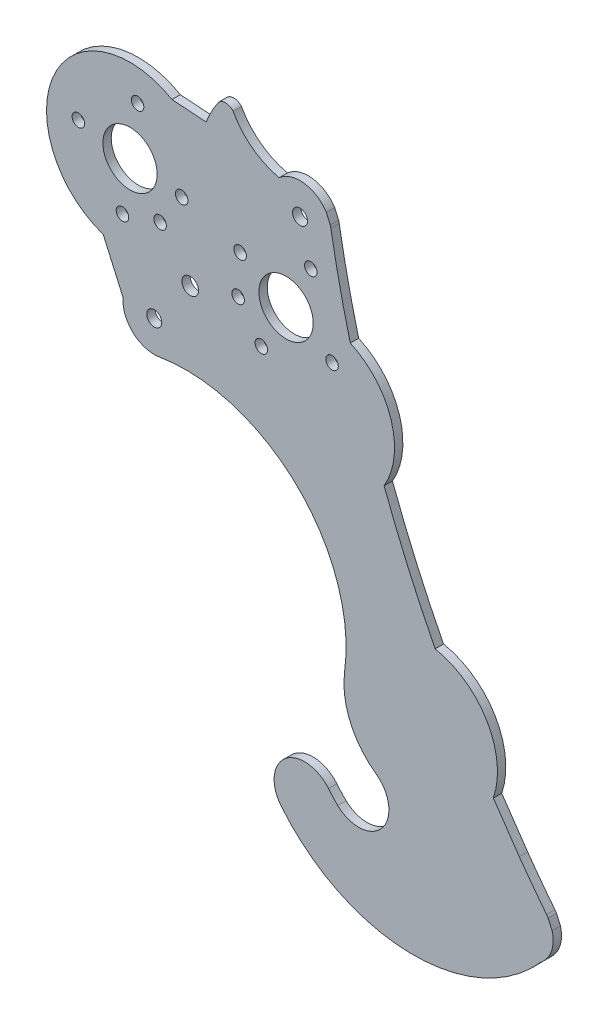
from build123d import *
from build123d.topology import SkipClean

# Parameters (mm, degrees)
SKETCH1_R            = 1.8
SKETCH1_R_2          = 2.75
EXTRUDE2_DEPTH       = 2
EXTRUDE3_START       = -2
EXTRUDE3_DEPTH       = 2
EXTRUDE4_DEPTH       = 2
EXTRUDE5_DEPTH       = 10
SKETCH5_R            = 3
EXTRUDE6_DEPTH       = 55
BOSS_EXTRUDE2_DEPTH  = 2
CUT_EXTRUDE2_DEPTH   = 10
BOSS_EXTRUDE3_DEPTH  = 2
CUT_EXTRUDE3_DEPTH   = 10
BOSS_EXTRUDE4_DEPTH  = 2
BOSS_EXTRUDE5_DEPTH  = 2
SKETCH11_R           = 3
CUT_EXTRUDE4_DEPTH   = 10
BOSS_EXTRUDE6_DEPTH  = 2
BOSS_EXTRUDE7_DEPTH  = 2
SKETCH16_R           = 3.342245342
SKETCH16_R_2         = 2
BOSS_EXTRUDE8_DEPTH  = 2
CUT_EXTRUDE5_DEPTH   = 2
SKETCH17_R           = 1.5
SKETCH17_R_2         = 6.5
SKETCH17_R_3         = 3
BOSS_EXTRUDE9_DEPTH  = 2
SKETCH17_2_R         = 1.5
SKETCH17_2_R_2       = 6.5
CUT_EXTRUDE6_DEPTH   = 2
BOSS_EXTRUDE11_DEPTH = 2
CUT_EXTRUDE8_DEPTH   = 2


with BuildPart() as part:
    # Sketch1 → Extrude2 (new body)
    with BuildSketch(Plane.XY):
        with BuildLine():
            Line((214.950942091, 33.616874637), (221.807190432, 36.656917184))
            Line((221.807190432, 36.656917184), (220.185834407, 40.313582966))
            Line((220.185834407, 40.313582966), (249.033490074, 53.104557885))
            ThreePointArc((249.033490074, 53.104557885), (251.717229956, 54.156321533), (254.312398254, 52.901822418))
            Line((254.312398254, 52.901822418), (279.296283012, 23.753956867))
            ThreePointArc((279.296283012, 23.753956867), (280.042564492, 18.410715952), (275.5, 15.5))
            Line((275.5, 15.5), (223.5, 15.5))
            ThreePointArc((223.5, 15.5), (220.722148835, 16.342651938), (218.880602337, 18.586582838))
            Line((218.880602337, 18.586582838), (211.044169952, 36.260192904))
            Line((211.044169952, 36.260192904), (213.329586066, 37.27354042))
            Line((213.329586066, 37.27354042), (214.950942091, 33.616874637))
        make_face()
        with Locations((275.5, 20.5)):
            Circle(SKETCH1_R, mode=Mode.SUBTRACT)
        with Locations((251.5, 48.5)):
            Circle(SKETCH1_R_2, mode=Mode.SUBTRACT)
        with Locations((223.5, 20.5)):
            Circle(SKETCH1_R, mode=Mode.SUBTRACT)
    extrude(amount=EXTRUDE2_DEPTH)

    # Sketch2 → Extrude3 (add)
    with BuildSketch(Plane.XY.offset(2).offset(EXTRUDE3_START)):
        with BuildLine():
            Line((275.035821138, 64.633923334), (251.401662381, 54.15459928))
            ThreePointArc((251.401662381, 54.15459928), (253.0022869, 53.865703947), (254.312398254, 52.901822418))
            Line((254.312398254, 52.901822418), (265.867761021, 39.420565857))
            Line((265.867761021, 39.420565857), (282.872253523, 46.960313268))
            Line((282.872253523, 46.960313268), (275.035821138, 64.633923334))
        make_face()
        with BuildLine():
            Line((264.774418622, 15.5), (268.520870849, 7.050576522))
            Line((268.520870849, 7.050576522), (295.302771445, 18.925601058))
            Line((295.302771445, 18.925601058), (282.872253523, 46.960313268))
            Line((282.872253523, 46.960313268), (265.867761021, 39.420565857))
            Line((265.867761021, 39.420565857), (279.296283012, 23.753956867))
            ThreePointArc((279.296283012, 23.753956867), (280.042564492, 18.410715952), (275.5, 15.5))
            Line((275.5, 15.5), (264.774418622, 15.5))
        make_face()
        with BuildLine():
            ThreePointArc((223.5, 15.5), (222.085748932, 15.704179537), (220.787002315, 16.300042433))
            ThreePointArc((220.787002315, 16.300042433), (243.759401886, 7.058869787), (268.520870849, 7.050576522))
            Line((268.520870849, 7.050576522), (264.774418622, 15.5))
            Line((264.774418622, 15.5), (223.5, 15.5))
        make_face()
        with BuildLine():
            Line((295.302771445, 18.925601058), (268.520870849, 7.050576522))
            ThreePointArc((268.520870849, 7.050576522), (282.58749462, 11.46423343), (295.302771445, 18.925601058))
        make_face()
    extrude(amount=EXTRUDE3_DEPTH)


with BuildPart() as body_2:
    # Mirror2: mirrored copy
    add(part.part.mirror(Plane(origin=(11.104903497, -25.045036387, 0), x_dir=(0, 0, 1), z_dir=(-0.4053390061385553, 0.9141664455134023, 0))))


with BuildPart() as part_1:
    add(part.part)

    add(body_2.part)  # Extrude4 merges body 2
    # Sketch3 → Extrude4 (add)
    with BuildSketch(Plane.XY.offset(2)):
        Polygon((275.035821138, 64.633923334), (254.768870831, 110.34224561), (190.777219645, 81.96851518), (211.044169952, 36.260192904), align=None)
    extrude(amount=-EXTRUDE4_DEPTH)

    # Sketch4 → Extrude5 (cut)
    with BuildSketch(Plane.XY.offset(2)):
        Polygon((262.406775751, 78.177359931), (258.750109969, 76.556003907), (252.670024877, 90.26850059), (256.326690659, 91.889856614), align=None)
        Polygon((286.72711612, 23.327373201), (283.070450338, 21.706017176), (276.990365245, 35.418513859), (280.647031028, 37.039869883), align=None)
        Polygon((234.429769601, 131.405990638), (238.086435383, 133.027346662), (232.006350291, 146.739843345), (228.349684509, 145.11848732), align=None)
    extrude(amount=-EXTRUDE5_DEPTH, mode=Mode.SUBTRACT)

    # Sketch5 → Extrude6 (cut)
    with BuildSketch(Plane.XY.offset(2)):
        with Locations((239.255071404, 76.116150138)):
            Circle(SKETCH5_R)
    extrude(amount=-EXTRUDE6_DEPTH, mode=Mode.SUBTRACT)

    # Sketch8 → Boss-Extrude2 (add)
    with BuildSketch(Plane(origin=(0, 0, 0), x_dir=(-1, 0, 0), z_dir=(0, 0, -1))):
        Polygon((-198.724451181, 91.591049062), (-189.767325125, 87.770757271), (-210.762968813, 38.543986786), (-219.72009487, 42.364278577), align=None)
    extrude(amount=-BOSS_EXTRUDE2_DEPTH)

    # Sketch6 → Cut-Extrude2 (cut)
    with BuildSketch(Plane.XY.offset(2)):
        Polygon((215.30566699, 32.68026603), (222.161915332, 35.720308576), (220.540559307, 39.376974358), (213.684310966, 36.336931812), align=None)
    cut_extrude2 = extrude(amount=-CUT_EXTRUDE2_DEPTH, mode=Mode.SUBTRACT)

    # Mirror3: Cut-Extrude2 across plane
    add(cut_extrude2.mirror(Plane(origin=(11.104903497, -25.045036387, 0), x_dir=(0, 0, 1), z_dir=(-0.4053390061385553, 0.9141664455134023, 0))), mode=Mode.SUBTRACT)

    # Sketch7 → Boss-Extrude3 (add)
    with BuildSketch(Plane(origin=(0, 0, 0), x_dir=(-1, 0, 0), z_dir=(0, 0, -1))):
        Polygon((-211.798895028, 37.450463228), (-220.540559307, 42.086184193), (-224.569673151, 34.488410116), (-215.828008872, 29.852689152), align=None)
        Polygon((-222.161915332, 35.720308576), (-215.30566699, 32.68026603), (-213.684310966, 36.336931812), (-220.540559307, 39.376974358), align=None, mode=Mode.SUBTRACT)
    extrude(amount=-BOSS_EXTRUDE3_DEPTH)

    # Sketch9 → Cut-Extrude3 (cut)
    # profile 1 of 2: a face of its own
    with BuildSketch(Plane(origin=(0, 0, 0), x_dir=(-1, 0, 0), z_dir=(0, 0, -1))):
        with BuildLine():
            ThreePointArc((-219.146363738, 109.909757579), (-206.3092142, 102.916198704), (-192.4024525, 107.422222786))
            ThreePointArc((-192.4024525, 107.422222786), (-188.200798595, 109.244218974), (-183.723031197, 108.283404333))
            ThreePointArc((-183.723031197, 108.283404333), (-202.191395683, 139.524441278), (-234.501920524, 156.050567885))
            Line((-234.501920524, 156.050567885), (-295.302771445, 18.925601058))
            ThreePointArc((-295.302771445, 18.925601058), (-261.362042522, 6.076095375), (-225.809806958, 13.364539832))
            ThreePointArc((-225.809806958, 13.364539832), (-229.528237165, 16.037897729), (-230.998958431, 20.375010202))
            ThreePointArc((-230.998958431, 20.375010202), (-236.996576126, 33.706583992), (-250.798334924, 38.524647068))
            ThreePointArc((-250.798334924, 38.524647068), (-262.929674492, 32.795643116), (-268.001041569, 20.375010202))
            ThreePointArc((-268.001041569, 20.375010202), (-276.541032207, 13.072601267), (-282.744361441, 22.441449797))
            Line((-282.744361441, 22.441449797), (-283.070450338, 21.706017176))
            Line((-283.070450338, 21.706017176), (-286.72711612, 23.327373201))
            Line((-286.72711612, 23.327373201), (-280.647031028, 37.039869883))
            Line((-280.647031028, 37.039869883), (-276.990365245, 35.418513859))
            Line((-276.990365245, 35.418513859), (-281.802666507, 24.565266892))
            ThreePointArc((-281.802666507, 24.565266892), (-281.613064316, 24.845163365), (-281.411041354, 25.116231158))
            ThreePointArc((-281.411041354, 25.116231158), (-263.21115929, 51.627791867), (-248.39673574, 80.169540469))
            ThreePointArc((-248.39673574, 80.169540469), (-237.191011643, 110.311376626), (-229.762847648, 141.599088576))
            ThreePointArc((-229.762847648, 141.599088576), (-229.697599093, 141.930801784), (-229.617468339, 142.259237605))
            Line((-229.617468339, 142.259237605), (-234.429769601, 131.405990638))
            Line((-234.429769601, 131.405990638), (-238.086435383, 133.027346662))
            Line((-238.086435383, 133.027346662), (-232.006350291, 146.739843345))
            Line((-232.006350291, 146.739843345), (-228.349684509, 145.11848732))
            Line((-228.349684509, 145.11848732), (-228.675773406, 144.3830547))
            ThreePointArc((-228.675773406, 144.3830547), (-220.254144747, 147.512230066), (-214.873106899, 140.317787808))
            ThreePointArc((-214.873106899, 140.317787808), (-215.491764103, 137.334983534), (-217.245672588, 134.844268155))
            ThreePointArc((-217.245672588, 134.844268155), (-223.045618241, 122.746684929), (-219.146363738, 109.909757579))
        make_face()
        Polygon((-252.670024877, 90.26850059), (-258.750109969, 76.556003907), (-262.406775751, 78.177359931), (-256.326690659, 91.889856614), align=None, mode=Mode.SUBTRACT)
    # profile 2 of 2: a face of its own
    with BuildSketch(Plane(origin=(0, 0, 0), x_dir=(-1, 0, 0), z_dir=(0, 0, -1))):
        with BuildLine():
            ThreePointArc((-185.157297666, 94.64319988), (-186.908989848, 94.301155277), (-188.691901235, 94.382684405))
            ThreePointArc((-188.691901235, 94.382684405), (-213.220264161, 90.307475736), (-230.113406869, 72.062760256))
            ThreePointArc((-230.113406869, 72.062760256), (-232.292402054, 47.293830066), (-218.844160197, 26.379894193))
            ThreePointArc((-218.844160197, 26.379894193), (-217.586691658, 25.113326831), (-216.664091931, 23.585508204))
            Line((-216.664091931, 23.585508204), (-185.157297666, 94.64319988))
        make_face()
        Polygon((-215.30566699, 32.68026603), (-222.161915332, 35.720308576), (-220.540559307, 39.376974358), (-213.684310966, 36.336931812), align=None, mode=Mode.SUBTRACT)
        Polygon((-197.841574963, 90.570295307), (-190.985326622, 87.530252761), (-192.606682647, 83.873586979), (-199.462930988, 86.913629525), align=None, mode=Mode.SUBTRACT)
    extrude(amount=-CUT_EXTRUDE3_DEPTH, mode=Mode.SUBTRACT)

    # Sketch9<3> → Boss-Extrude4 (add)
    with SkipClean():  # the faces are left unmerged after this step: merging them gives an invalid solid
        with BuildSketch(Plane(origin=(0, 0, 0), x_dir=(-1, 0, 0), z_dir=(0, 0, -1))):
            with BuildLine():
                ThreePointArc((-179.960276728, 101.780866687), (-180.968769142, 105.537238508), (-183.723031197, 108.283404333))
                ThreePointArc((-183.723031197, 108.283404333), (-183.061079526, 105.450124932), (-182.526202408, 102.590132162))
                ThreePointArc((-182.526202408, 102.590132162), (-182.508998785, 101.084557319), (-182.94078726, 99.642125246))
                Line((-182.94078726, 99.642125246), (-185.157297666, 94.64319988))
                ThreePointArc((-185.157297666, 94.64319988), (-181.397177563, 97.366251356), (-179.960276728, 101.780866687))
            make_face()
            with BuildLine():
                ThreePointArc((-216, 20.5), (-216.167902397, 22.078082616), (-216.664091931, 23.585508204))
                Line((-216.664091931, 23.585508204), (-218.880602337, 18.586582838))
                ThreePointArc((-218.880602337, 18.586582838), (-219.659677978, 17.298136985), (-220.787001942, 16.300042674))
                ThreePointArc((-220.787001942, 16.300042674), (-223.265644053, 14.776236432), (-225.809806958, 13.364539832))
                ThreePointArc((-225.809806958, 13.364539832), (-219.088285605, 14.434789691), (-216, 20.5))
            make_face()
        extrude(amount=-BOSS_EXTRUDE4_DEPTH)

    # Sketch10 → Boss-Extrude5 (add)
    with SkipClean():  # the faces are left unmerged after this step: merging them gives an invalid solid
        with BuildSketch(Plane(origin=(0, 0, 0), x_dir=(-1, 0, 0), z_dir=(0, 0, -1))):
            with BuildLine():
                ThreePointArc((-235.958744639, 114.499032615), (-240.356731212, 107.959424354), (-240.525431642, 100.080318931))
                ThreePointArc((-240.525431642, 100.080318931), (-240.529519907, 96.974501167), (-242.511726994, 94.58348135))
                ThreePointArc((-242.511726994, 94.58348135), (-244.170042184, 109.167174091), (-234.418395851, 120.137110145))
                ThreePointArc((-234.418395851, 120.137110145), (-234.3000474, 117.07532284), (-235.958744639, 114.499032615))
            make_face()
            with BuildLine():
                ThreePointArc((-213.057679374, 104.885020596), (-211.080001731, 104.010099861), (-209.013751259, 103.371896019))
                ThreePointArc((-209.013751259, 103.371896019), (-212.855340343, 114.851723245), (-223.099104635, 121.302268415))
                ThreePointArc((-223.099104635, 121.302268415), (-222.968296994, 119.143661337), (-222.586531621, 117.015058425))
                ThreePointArc((-222.586531621, 117.015058425), (-216.000852002, 112.380740363), (-213.057679374, 104.885020596))
            make_face()
            with BuildLine():
                ThreePointArc((-239.150118611, 35.404946366), (-241.010369821, 36.507743079), (-242.986582803, 37.385967085))
                ThreePointArc((-242.986582803, 37.385967085), (-250.517668332, 34.534505934), (-258.373765711, 36.303633945))
                ThreePointArc((-258.373765711, 36.303633945), (-260.207579406, 35.157412985), (-261.895135861, 33.805063782))
                ThreePointArc((-261.895135861, 33.805063782), (-250.237002141, 30.544364773), (-239.150118611, 35.404946366))
            make_face()
            with BuildLine():
                ThreePointArc((-268.631422006, 42.976017735), (-261.826080652, 42.099863238), (-265.487264056, 47.902970486))
                ThreePointArc((-265.487264056, 47.902970486), (-263.593606182, 55.552991529), (-257.867708976, 60.968050465))
                ThreePointArc((-257.867708976, 60.968050465), (-255.684077657, 63.117539269), (-255.127631976, 66.130663239))
                ThreePointArc((-255.127631976, 66.130663239), (-267.048922235, 57.568131966), (-268.631422006, 42.976017735))
            make_face()
        extrude(amount=-BOSS_EXTRUDE5_DEPTH)

    # Sketch11 → Cut-Extrude4 (cut)
    with SkipClean():  # the faces are left unmerged after this step: merging them gives an invalid solid
        with BuildSketch(Plane(origin=(0, 0, 0), x_dir=(-1, 0, 0), z_dir=(0, 0, -1))):
            with Locations((-227.010142808, 103.732300275)):
                Circle(SKETCH11_R)
            with BuildLine():
                ThreePointArc((-213.058581143, 104.895884011), (-216.676051769, 113.177222848), (-224.599393661, 117.52317728))
                ThreePointArc((-224.599393661, 117.52317728), (-221.843097289, 108.454761562), (-213.058581143, 104.895884011))
            make_face()
            with BuildLine():
                ThreePointArc((-216.272267555, 94.74909177), (-225.503894125, 96.89627695), (-232.978230566, 91.068101583))
                ThreePointArc((-232.978230566, 91.068101583), (-223.997645443, 90.060253625), (-216.272267555, 94.74909177))
            make_face()
            with BuildLine():
                ThreePointArc((-240.158767208, 98.924631776), (-233.68343701, 105.845862315), (-234.993616715, 115.232915232))
                ThreePointArc((-234.993616715, 115.232915232), (-240.356731212, 107.959424354), (-240.158767208, 98.924631776))
            make_face()
        cut_extrude4 = extrude(amount=-CUT_EXTRUDE4_DEPTH, mode=Mode.SUBTRACT)

    # Sketch13 → Boss-Extrude6 (add)
    with BuildSketch(Plane(origin=(0, 0, 0), x_dir=(-1, 0, 0), z_dir=(0, 0, -1))):
        with BuildLine():
            ThreePointArc((-221.016225319, 141.500527161), (-218.054735197, 141.716298083), (-215.154232385, 142.351958587))
            ThreePointArc((-215.154232385, 142.351958587), (-216.00972223, 144.28733886), (-217.371744244, 145.906738657))
            ThreePointArc((-217.371744244, 145.906738657), (-222.057051315, 145.531261724), (-226.662688019, 146.469982035))
            ThreePointArc((-226.662688019, 146.469982035), (-227.771045753, 145.524730877), (-228.675773406, 144.3830547))
            Line((-228.675773406, 144.3830547), (-229.617468339, 142.259237605))
            ThreePointArc((-229.617468339, 142.259237605), (-229.697599093, 141.930801784), (-229.762847648, 141.599088576))
            ThreePointArc((-229.762847648, 141.599088576), (-231.865618613, 130.819291514), (-234.418395851, 120.137110145))
            Line((-234.418395851, 120.137110145), (-227.995019703, 140.663401272))
            ThreePointArc((-227.995019703, 140.663401272), (-227.083713367, 141.799635698), (-225.643399707, 142.016440843))
            ThreePointArc((-225.643399707, 142.016440843), (-224.61484051, 141.810023984), (-223.577174628, 141.655779176))
            ThreePointArc((-223.577174628, 141.655779176), (-222.264185757, 142.114489281), (-221.016225319, 141.500527161))
        make_face()
        with BuildLine():
            ThreePointArc((-203.346022961, 146.479774244), (-205.604715324, 129.417281213), (-220.281674353, 120.427440654))
            ThreePointArc((-220.281674353, 120.427440654), (-217.65856338, 119.112416082), (-215.283961995, 117.388679135))
            ThreePointArc((-215.283961995, 117.388679135), (-199.601215049, 132.738807559), (-202.957311315, 154.425476558))
            ThreePointArc((-202.957311315, 154.425476558), (-204.68739073, 155.016803958), (-206.328873231, 154.211584687))
            ThreePointArc((-206.328873231, 154.211584687), (-210.955849283, 148.869807849), (-217.371744244, 145.906738657))
            ThreePointArc((-217.371744244, 145.906738657), (-216.00972223, 144.28733886), (-215.154232385, 142.351958587))
            ThreePointArc((-215.154232385, 142.351958587), (-210.596914714, 144.316170629), (-206.635274013, 147.304928943))
            ThreePointArc((-206.635274013, 147.304928943), (-204.76208278, 147.803465588), (-203.346022961, 146.479774244))
        make_face()
    boss_extrude6 = extrude(amount=-BOSS_EXTRUDE6_DEPTH)

    # Sketch14 → Boss-Extrude7 (add)
    with SkipClean():  # the faces are left unmerged after this step: merging them gives an invalid solid
        with BuildSketch(Plane(origin=(0, 0, 0), x_dir=(-1, 0, 0), z_dir=(0, 0, -1))):
            with BuildLine():
                Line((-204.620489613, 124.167104246), (-201.438511078, 128.5814043))
                ThreePointArc((-201.438511078, 128.5814043), (-196.896529827, 117.158820126), (-187.460276728, 109.280866687))
                Line((-187.460276728, 109.280866687), (-192.367992506, 107.452226827))
                ThreePointArc((-192.367992506, 107.452226827), (-200.038082842, 114.677984071), (-204.620489613, 124.167104246))
            make_face()
        boss_extrude7 = extrude(amount=-BOSS_EXTRUDE7_DEPTH)

    # Mirror5: Cut-Extrude4, Boss-Extrude6, Boss-Extrude7 across plane
    with SkipClean():  # the faces are left unmerged after this step: merging them gives an invalid solid
        add(cut_extrude4.mirror(Plane(origin=(11.104903497, -25.045036387, 0), x_dir=(0, 0, 1), z_dir=(-0.4053390061385553, 0.9141664455134023, 0))), mode=Mode.SUBTRACT)
        add(boss_extrude6.mirror(Plane(origin=(11.104903497, -25.045036387, 0), x_dir=(0, 0, 1), z_dir=(-0.4053390061385553, 0.9141664455134023, 0))))
        add(boss_extrude7.mirror(Plane(origin=(11.104903497, -25.045036387, 0), x_dir=(0, 0, 1), z_dir=(-0.4053390061385553, 0.9141664455134023, 0))))

    # Sketch16 → Boss-Extrude8 (add)
    with SkipClean():  # the faces are left unmerged after this step: merging them gives an invalid solid
        with BuildSketch(Plane(origin=(0, 0, 0), x_dir=(-1, 0, 0), z_dir=(0, 0, -1))):
            with Locations((-196.067694097, 112.822259998)):
                Circle(SKETCH16_R)
            with Locations((-196.067694097, 112.822259998)):
                Circle(SKETCH16_R_2, mode=Mode.SUBTRACT)
        extrude(amount=-BOSS_EXTRUDE8_DEPTH)

    # Sketch16<3> → Cut-Extrude5 (cut)
    with SkipClean():  # the faces are left unmerged after this step: merging them gives an invalid solid
        with BuildSketch(Plane(origin=(0, 0, 0), x_dir=(-1, 0, 0), z_dir=(0, 0, -1))):
            with BuildLine():
                ThreePointArc((-194.067694097, 112.822259998), (-196.352454438, 114.80188409), (-197.986605645, 112.258541565))
                ThreePointArc((-197.986605645, 112.258541565), (-195.782933755, 110.842635905), (-194.067694097, 112.822259998))
            make_face()
        extrude(amount=-CUT_EXTRUDE5_DEPTH, mode=Mode.SUBTRACT)

    # Sketch17 → Boss-Extrude9 (add)
    # profile 1 of 12: a face of its own
    with SkipClean():  # the faces are left unmerged after this step: merging them gives an invalid solid
        with BuildSketch(Plane(origin=(0, 0, 0), x_dir=(-1, 0, 0), z_dir=(0, 0, -1))):
            with BuildLine():
                ThreePointArc((-195.256872657, 109.579857721), (-198.456654349, 110.484852708), (-199.291638938, 113.703613267))
                ThreePointArc((-199.291638938, 113.703613267), (-202.49110624, 118.662872381), (-204.620489613, 124.167104246))
                ThreePointArc((-204.620489613, 124.167104246), (-208.352437733, 120.839060022), (-212.693002536, 118.3565588))
                ThreePointArc((-212.693002536, 118.3565588), (-213.119760912, 117.097782535), (-213.793648584, 115.952131715))
                ThreePointArc((-213.793648584, 115.952131715), (-210.183775342, 110.125527777), (-209.013751259, 103.371896019))
                ThreePointArc((-209.013751259, 103.371896019), (-200.212222832, 103.363348178), (-192.4024525, 107.422222786))
                ThreePointArc((-192.4024525, 107.422222786), (-192.385245352, 107.437251049), (-192.367992506, 107.452226827))
                ThreePointArc((-192.367992506, 107.452226827), (-193.845361891, 108.471331122), (-195.256872657, 109.579857721))
            make_face()
            with Locations((-207.548831665, 116.312744223)):
                Circle(SKETCH17_R, mode=Mode.SUBTRACT)
        # profile 2 of 12: a face of its own
        with BuildSketch(Plane(origin=(0, 0, 0), x_dir=(-1, 0, 0), z_dir=(0, 0, -1))):
            with BuildLine():
                ThreePointArc((-201.438511078, 128.5814043), (-199.641859665, 122.008004027), (-196.137202482, 116.163782482))
                ThreePointArc((-196.137202482, 116.163782482), (-193.678733844, 115.159667287), (-192.728482775, 112.679881355))
                ThreePointArc((-192.728482775, 112.679881355), (-190.201332664, 110.814605398), (-187.460276728, 109.280866687))
                ThreePointArc((-187.460276728, 109.280866687), (-182.36947479, 107.288473756), (-179.983440264, 102.369862856))
                Line((-179.983440264, 102.369862856), (-175.239612501, 113.06868063))
                ThreePointArc((-175.239612501, 113.06868063), (-163.447059079, 140.28865089), (-191.709742076, 149.300412479))
                Line((-191.709742076, 149.300412479), (-199.8952226, 148.728775707))
                ThreePointArc((-199.8952226, 148.728775707), (-198.443209256, 138.484757852), (-201.438511078, 128.5814043))
            make_face()
            with Locations((-194.023125782, 130.206864575)):
                Circle(SKETCH17_R, mode=Mode.SUBTRACT)
            with Locations((-188.86093151, 122.417184334)):
                Circle(SKETCH17_R, mode=Mode.SUBTRACT)
            with Locations((-179.848924828, 119.643151812)):
                Circle(SKETCH17_R, mode=Mode.SUBTRACT)
            with Locations((-181.654168924, 132.01210867)):
                Circle(SKETCH17_R_2, mode=Mode.SUBTRACT)
            with Locations((-169.285212066, 133.817352766)):
                Circle(SKETCH17_R, mode=Mode.SUBTRACT)
            with Locations((-183.45941302, 144.381065528)):
                Circle(SKETCH17_R, mode=Mode.SUBTRACT)
        # profile 3 of 12: a face of its own
        with BuildSketch(Plane(origin=(0, 0, 0), x_dir=(-1, 0, 0), z_dir=(0, 0, -1))):
            with BuildLine():
                ThreePointArc((-214.328386474, 109.662987949), (-215.534492293, 111.751617282), (-217.081182757, 113.602242135))
                ThreePointArc((-217.081182757, 113.602242135), (-221.425332768, 113.760693092), (-224.69813186, 116.62172999))
                ThreePointArc((-224.69813186, 116.62172999), (-221.536685138, 108.132812492), (-213.07667556, 104.894803289))
                ThreePointArc((-213.07667556, 104.894803289), (-213.067178879, 104.8899092), (-213.057679374, 104.885020596))
                ThreePointArc((-213.057679374, 104.885020596), (-213.216220916, 106.125565582), (-213.484838466, 107.347012222))
                ThreePointArc((-213.484838466, 107.347012222), (-214.512583474, 108.284287223), (-214.328386474, 109.662987949))
            make_face()
        # profile 4 of 12: a face of its own
        with BuildSketch(Plane(origin=(0, 0, 0), x_dir=(-1, 0, 0), z_dir=(0, 0, -1))):
            with BuildLine():
                ThreePointArc((-222.698721508, 125.168883745), (-217.324246654, 126.075429855), (-213.149098888, 122.57186782))
                ThreePointArc((-213.149098888, 122.57186782), (-211.196703017, 123.732010881), (-209.38842077, 125.106018478))
                ThreePointArc((-209.38842077, 125.106018478), (-209.076244393, 126.799420575), (-207.37791632, 127.083579879))
                ThreePointArc((-207.37791632, 127.083579879), (-202.791690204, 136.247392222), (-203.346022961, 146.479774244))
                ThreePointArc((-203.346022961, 146.479774244), (-204.76208278, 147.803465588), (-206.635274013, 147.304928943))
                ThreePointArc((-206.635274013, 147.304928943), (-210.596914714, 144.316170629), (-215.154232385, 142.351958587))
                ThreePointArc((-215.154232385, 142.351958587), (-215.148206256, 138.305125218), (-217.245672588, 134.844268155))
                ThreePointArc((-217.245672588, 134.844268155), (-220.715243365, 130.425357028), (-222.698721508, 125.168883745))
            make_face()
        # profile 5 of 12: a face of its own
        with BuildSketch(Plane(origin=(0, 0, 0), x_dir=(-1, 0, 0), z_dir=(0, 0, -1))):
            with BuildLine():
                ThreePointArc((-240.158767208, 98.924631776), (-233.68343701, 105.845862315), (-234.993616715, 115.232915232))
                ThreePointArc((-234.993616715, 115.232915232), (-240.356731212, 107.959424354), (-240.158767208, 98.924631776))
            make_face()
        # profile 6 of 12: a face of its own
        with BuildSketch(Plane(origin=(0, 0, 0), x_dir=(-1, 0, 0), z_dir=(0, 0, -1))):
            with BuildLine():
                ThreePointArc((-232.978230566, 91.068101583), (-223.997645443, 90.060253625), (-216.272267555, 94.74909177))
                ThreePointArc((-216.272267555, 94.74909177), (-225.503894125, 96.89627695), (-232.978230566, 91.068101583))
            make_face()
        # profile 7 of 12: a face of its own
        with BuildSketch(Plane(origin=(0, 0, 0), x_dir=(-1, 0, 0), z_dir=(0, 0, -1))):
            with Locations((-239.255071404, 76.116150138)):
                Circle(SKETCH17_R_3)
        # profile 8 of 12: a face of its own
        with BuildSketch(Plane(origin=(0, 0, 0), x_dir=(-1, 0, 0), z_dir=(0, 0, -1))):
            with BuildLine():
                ThreePointArc((-237.633176679, 46.57354964), (-239.345127072, 55.446874413), (-246.121607852, 61.42566818))
                ThreePointArc((-246.121607852, 61.42566818), (-245.422563536, 51.973437206), (-237.633176679, 46.57354964))
            make_face()
        # profile 9 of 12: a face of its own
        with BuildSketch(Plane(origin=(0, 0, 0), x_dir=(-1, 0, 0), z_dir=(0, 0, -1))):
            with BuildLine():
                ThreePointArc((-265.383153079, 46.694990142), (-257.546803091, 52.026495764), (-256.76505671, 61.472246445))
                ThreePointArc((-256.76505671, 61.472246445), (-263.593606182, 55.552991529), (-265.383153079, 46.694990142))
            make_face()
        # profile 10 of 12: a face of its own
        with BuildSketch(Plane(origin=(0, 0, 0), x_dir=(-1, 0, 0), z_dir=(0, 0, -1))):
            with BuildLine():
                ThreePointArc((-260.101766611, 37.454203914), (-251.555816404, 34.500111267), (-242.986582803, 37.385967085))
                ThreePointArc((-242.986582803, 37.385967085), (-242.996583695, 37.389724906), (-243.006586754, 37.393476951))
                ThreePointArc((-243.006586754, 37.393476951), (-251.539696633, 41.500102958), (-260.101766611, 37.454203914))
            make_face()
        # profile 11 of 12: a face of its own
        with BuildSketch(Plane(origin=(0, 0, 0), x_dir=(-1, 0, 0), z_dir=(0, 0, -1))):
            with Locations((-227.010142808, 103.732300275)):
                Circle(SKETCH17_R_3)
        # profile 12 of 12: a face of its own
        with BuildSketch(Plane(origin=(0, 0, 0), x_dir=(-1, 0, 0), z_dir=(0, 0, -1))):
            with Locations((-251.5, 48.5)):
                Circle(SKETCH17_R_3)
        extrude(amount=-BOSS_EXTRUDE9_DEPTH)

    # Sketch17<2> → Cut-Extrude6 (cut)
    with SkipClean():  # the faces are left unmerged after this step: merging them gives an invalid solid
        with BuildSketch(Plane(origin=(0, 0, 0), x_dir=(-1, 0, 0), z_dir=(0, 0, -1))):
            with Locations((-208.024381592, 125.730035402)):
                Circle(SKETCH17_2_R)
            with Locations((-213.103162281, 108.797640807)):
                Circle(SKETCH17_2_R)
            with Locations((-230.035556876, 113.876421496)):
                Circle(SKETCH17_2_R)
            with Locations((-224.956776187, 130.80881609)):
                Circle(SKETCH17_2_R)
            with Locations((-219.029969234, 119.803228449)):
                Circle(SKETCH17_2_R_2)
        extrude(amount=-CUT_EXTRUDE6_DEPTH, mode=Mode.SUBTRACT)

    # Sketch20 → Boss-Extrude11 (add)
    with BuildSketch(Plane(origin=(0, 0, 0), x_dir=(-1, 0, 0), z_dir=(0, 0, -1))):
        with BuildLine():
            ThreePointArc((-233.057835453, 51.301509311), (-255.4977375, 66.712280105), (-268.685055863, 42.897669154))
            Line((-268.685055863, 42.897669154), (-280.11525828, 26.200377698))
            ThreePointArc((-280.11525828, 26.200377698), (-282.794256152, 21.267295299), (-281.200377698, 15.88474172))
            ThreePointArc((-281.200377698, 15.88474172), (-279.248886566, 13.64623287), (-277.139692774, 11.555648966))
            Line((-277.139692774, 11.555648966), (-297.593291101, 8.097255455))
            Line((-297.593291101, 8.097255455), (-251.276353518, -34.342963605))
            Line((-251.276353518, -34.342963605), (-205.80187291, 22.716582118))
            Line((-205.80187291, 22.716582118), (-233.057835453, 51.301509311))
        make_face()
    extrude(amount=-BOSS_EXTRUDE11_DEPTH)

    # Sketch20<3> → Cut-Extrude8 (cut)
    with BuildSketch(Plane(origin=(0, 0, 0), x_dir=(-1, 0, 0), z_dir=(0, 0, -1))):
        with BuildLine():
            Line((-205.80187291, 22.716582118), (-233.057835453, 51.301509311))
            ThreePointArc((-233.057835453, 51.301509311), (-234.401197116, 41.514066989), (-240.616000357, 33.83455734))
            ThreePointArc((-240.616000357, 33.83455734), (-241.993163673, 23.31786387), (-231.40374062, 22.716582118))
            ThreePointArc((-231.40374062, 22.716582118), (-230.264632981, 23.881541463), (-229.200377698, 25.11525828))
            ThreePointArc((-229.200377698, 25.11525828), (-218.88474172, 26.200377698), (-217.799622302, 15.88474172))
            ThreePointArc((-217.799622302, 15.88474172), (-246.532248068, 0.870864736), (-277.139692774, 11.555648966))
            Line((-277.139692774, 11.555648966), (-297.593291101, 8.097255455))
            Line((-297.593291101, 8.097255455), (-251.276353518, -34.342963605))
            Line((-251.276353518, -34.342963605), (-205.80187291, 22.716582118))
        make_face()
    extrude(amount=-CUT_EXTRUDE8_DEPTH, mode=Mode.SUBTRACT)


solid = part_1.part
